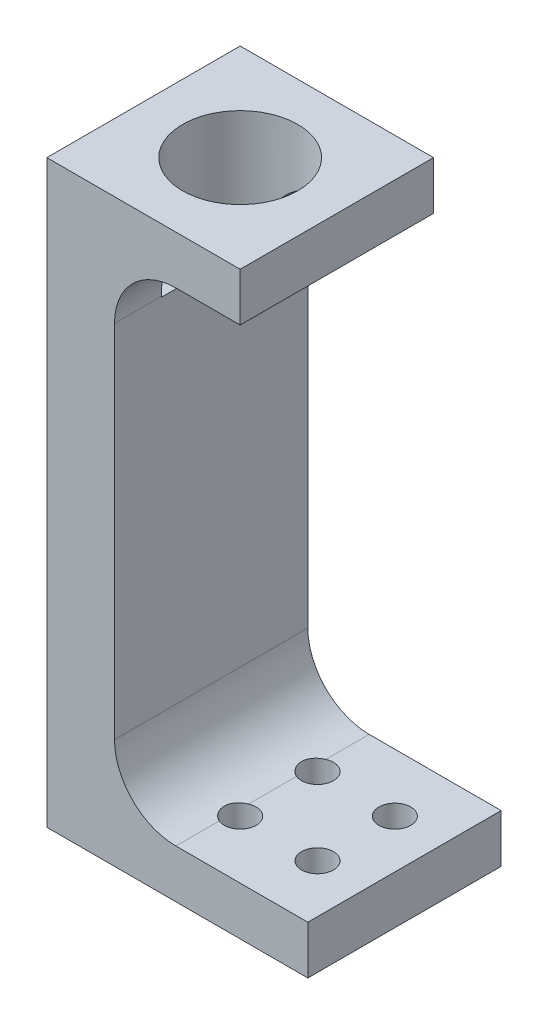
from build123d import *

# Parameters (mm, degrees)
BOSS_EXTRUDE1_DEPTH       = 20
FILLET1_R                 = 6.35
M4X0_7_TAPPED_HOLE1_D     = 3.3
M4X0_7_TAPPED_HOLE1_DEPTH = 10.1
M4X0_7_TAPPED_HOLE1_TIP   = 0.991420021
SKETCH5_R                 = 5.9563
CUT_EXTRUDE1_DEPTH        = 11.43


with BuildPart() as part:
    # Sketch1 → Boss-Extrude1 (new body)
    with BuildSketch(Plane.XY):
        Polygon((0, 0), (27, 0), (27, 5), (7, 5), (7, 55), (20, 55), (20, 60), (0, 60), align=None)
    extrude(amount=BOSS_EXTRUDE1_DEPTH)

    # Fillet1
    fillet1_edges = [part.edges().sort_by_distance(p)[0] for p in [
        (7, 55, 10),
        (7, 5, 10),
    ]]
    fillet(fillet1_edges, radius=FILLET1_R)

    # M4x0.7 Tapped Hole1
    with Locations(Plane(origin=(0, 0, 0), x_dir=(-1, 0, 0), z_dir=(0, -1, 0))):
        with Locations((-22, -14), (-22, -6), (-14, -6), (-14, -14)):
            Hole(M4X0_7_TAPPED_HOLE1_D / 2, depth=M4X0_7_TAPPED_HOLE1_DEPTH)
            with Locations((0, 0, -(M4X0_7_TAPPED_HOLE1_DEPTH + M4X0_7_TAPPED_HOLE1_TIP / 2))):  # 118° drill point
                Cone(0, M4X0_7_TAPPED_HOLE1_D / 2, M4X0_7_TAPPED_HOLE1_TIP, mode=Mode.SUBTRACT)

    # Sketch5 → Cut-Extrude1 (cut)
    with BuildSketch(Plane.XZ.offset(-60)):
        with Locations(Location((10, 10, 0), (0, 0, 120.242996609))):
            Circle(SKETCH5_R)
    extrude(amount=CUT_EXTRUDE1_DEPTH, mode=Mode.SUBTRACT)


solid = part.part
